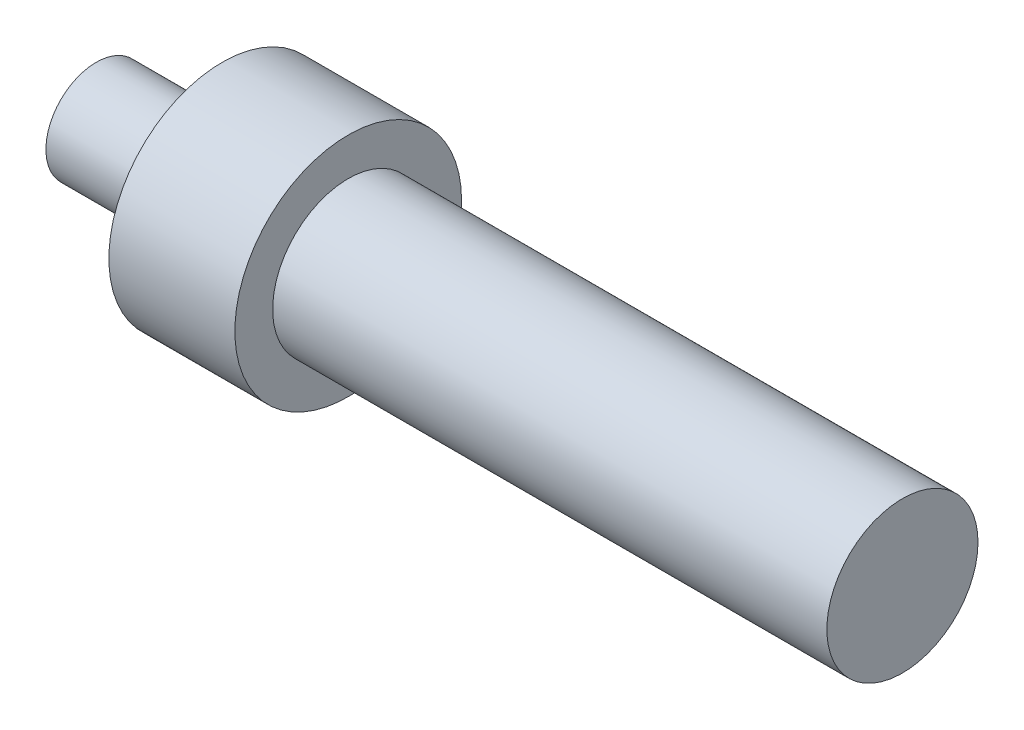
from build123d import *


with BuildPart() as part:
    # Sketch1 → Revolve1 (revolve)
    with BuildSketch(Plane.XY, mode=Mode.PRIVATE) as revolve1_sk:
        Polygon((0, 0), (0, 4), (10, 4), (10, 9), (20, 9), (20, 6), (64, 6), (64, 0), align=None)
    revolve(revolve1_sk.sketch.rotate(Axis((0, 0, 0), (-1, 0, 0)), 90), axis=Axis((0, 0, 0), (-1, 0, 0)))


solid = part.part
